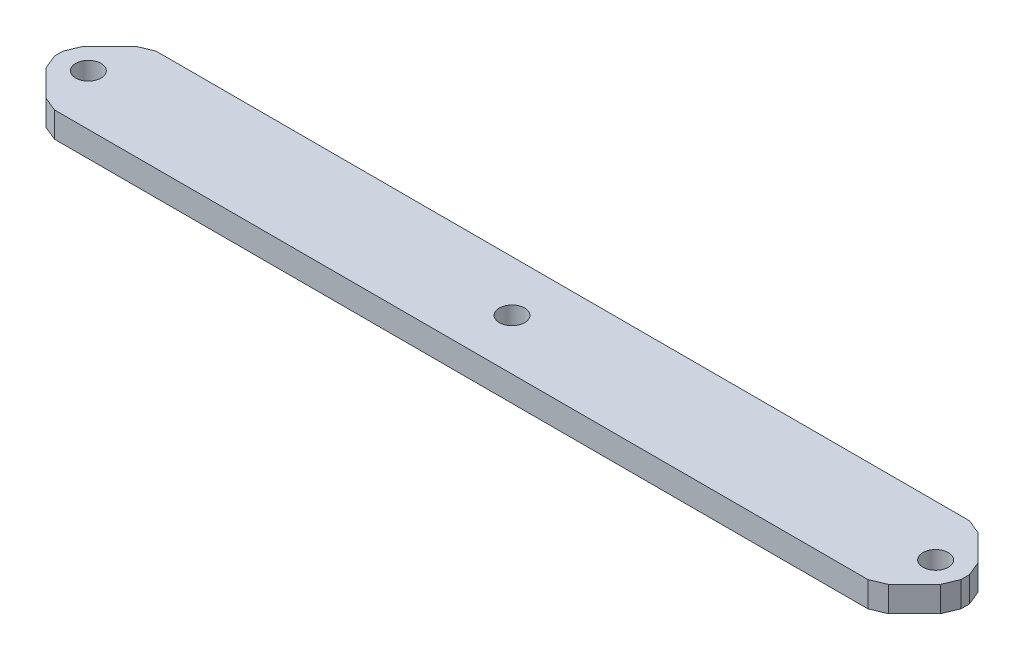
from build123d import *

# Parameters (mm, degrees)
SKETCH1_R               = 1.5
BOSS_EXTRUDE1_DEPTH     = 3
CUT_EXTRUDE1_DEPTH      = 56.407580709
CUT_EXTRUDE1_DEPTH_BACK = 56.407580709
CUT_EXTRUDE2_DEPTH      = 54.918920612
CUT_EXTRUDE2_DEPTH_BACK = 54.918920612
CHAMFER1_SIZE           = 1


with BuildPart() as part:
    # Sketch1 → Boss-Extrude1 (new body)
    with BuildSketch(Plane(origin=(0, 0, 0), x_dir=(1, 0, 0), z_dir=(0, 1, 0))):
        Polygon((-55, 3), (-52, 6), (52, 6), (55, 3), (55, -3), (52, -6), (-52, -6), (-55, -3), align=None)
        with Locations(Location((-50, 0, 0), (0, 0, 270))):
            Circle(SKETCH1_R, mode=Mode.SUBTRACT)
        with Locations(Location((0, 0, 0), (0, 0, 270))):
            Circle(SKETCH1_R, mode=Mode.SUBTRACT)
        with Locations(Location((50, 0, 0), (0, 0, 270))):
            Circle(SKETCH1_R, mode=Mode.SUBTRACT)
    extrude(amount=BOSS_EXTRUDE1_DEPTH)

    # Sketch2 → Cut-Extrude1 (cut, two sides: drawn at the far end of the back side and taken through both)
    with BuildSketch(Plane(origin=(0, 3, 0), x_dir=(1, 0, 0), z_dir=(0, 1, 0)).offset(-CUT_EXTRUDE1_DEPTH_BACK)):
        Polygon((-53.5, 4.5), (-53.5, -4.5), (-55, -3), (-55, 3), align=None)
        Polygon((53.5, -4.5), (55, -3), (55, 3), (53.5, 4.5), align=None)
    extrude(amount=CUT_EXTRUDE1_DEPTH + CUT_EXTRUDE1_DEPTH_BACK, mode=Mode.SUBTRACT)

    # Sketch3 → Cut-Extrude2 (cut, two sides: drawn at the far end of the back side and taken through both)
    with BuildSketch(Plane(origin=(0, 3, 0), x_dir=(1, 0, 0), z_dir=(0, 1, 0)).offset(-CUT_EXTRUDE2_DEPTH_BACK)):
        Polygon((-49, -6), (-53.5, -1.5), (-53.5, -4.5), (-52, -6), align=None)
        Polygon((-53.5, 4.5), (-53.5, 1.5), (-49, 6), (-52, 6), align=None)
        Polygon((52, 6), (49, 6), (53.5, 1.5), (53.5, 4.5), align=None)
        Polygon((53.5, -1.5), (49, -6), (52, -6), (53.5, -4.5), align=None)
    extrude(amount=CUT_EXTRUDE2_DEPTH + CUT_EXTRUDE2_DEPTH_BACK, mode=Mode.SUBTRACT)

    # Chamfer1
    chamfer1_edges = [part.edges().sort_by_distance(p)[0] for p in [
        (49, 1.5, -6),
        (53.5, 1.5, -1.5),
        (-53.5, 1.5, -1.5),
        (-49, 1.5, -6),
        (-49, 1.5, 6),
        (-53.5, 1.5, 1.5),
        (53.5, 1.5, 1.5),
        (49, 1.5, 6),
    ]]
    chamfer(chamfer1_edges, length=CHAMFER1_SIZE)


solid = part.part
